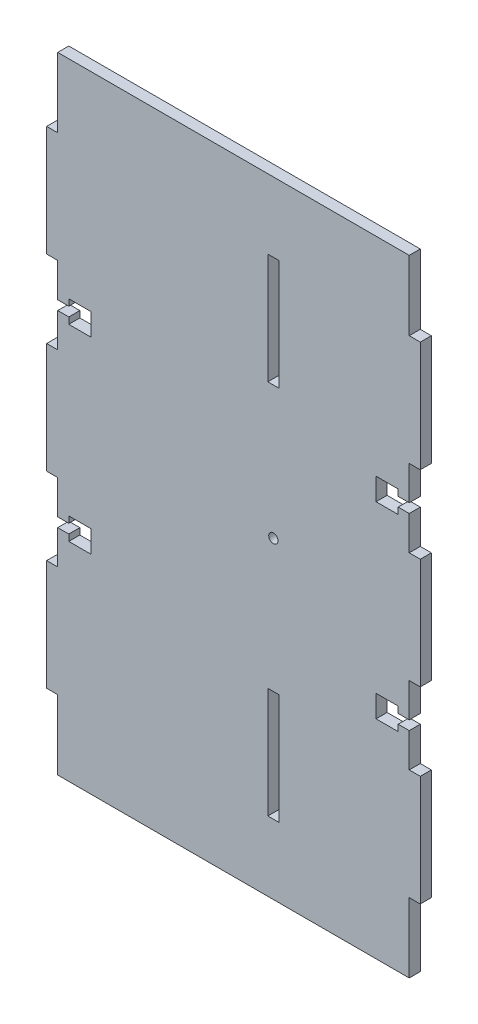
from build123d import *

# Parameters (mm, degrees)
ESQUISSE1_R        = 2.1
ESQUISSE1_W        = 5
ESQUISSE1_H        = 50
BOSS_EXTRU_1_DEPTH = 5


with BuildPart() as part:
    # Esquisse1 → Boss.-Extru.1 (new body)
    with BuildSketch(Plane.XY):
        Polygon((0, -3.53), (0, -35), (-5, -35), (-5, -85), (0, -85), (0, -100.4), (5, -100.4), (5, -97.5), (15, -97.5), (15, -107.5), (5, -107.5), (5, -104.6), (0, -104.6), (0, -120), (-5, -120), (-5, -170), (0, -170), (0, -185.4), (5, -185.4), (5, -182.5), (15, -182.5), (15, -192.5), (5, -192.5), (5, -189.6), (0, -189.6), (0, -205), (-5, -205), (-5, -255), (0, -255), (0, -286.47), (158.918484905, -286.47), (158.918484905, -255), (163.918484905, -255), (163.918484905, -205), (158.918484905, -205), (158.918484905, -189.6), (153.918484905, -189.6), (153.918484905, -192.5), (143.918484905, -192.5), (143.918484905, -182.5), (153.918484905, -182.5), (153.918484905, -185.4), (158.918484905, -185.4), (158.918484905, -170), (163.918484905, -170), (163.918484905, -120), (158.918484905, -120), (158.918484905, -104.6), (153.918484905, -104.6), (153.918484905, -107.5), (143.918484905, -107.5), (143.918484905, -97.5), (153.918484905, -97.5), (153.918484905, -100.4), (158.918484905, -100.4), (158.918484905, -85), (163.918484905, -85), (163.918484905, -35), (158.918484905, -35), (158.918484905, -3.53), align=None)
        with Locations((97.5, -145)):
            Circle(ESQUISSE1_R, mode=Mode.SUBTRACT)
        with Locations((97.5, -60)):
            Rectangle(ESQUISSE1_W, ESQUISSE1_H, mode=Mode.SUBTRACT)
        with Locations((97.5, -230)):
            Rectangle(ESQUISSE1_W, ESQUISSE1_H, mode=Mode.SUBTRACT)
    extrude(amount=BOSS_EXTRU_1_DEPTH)


solid = part.part
